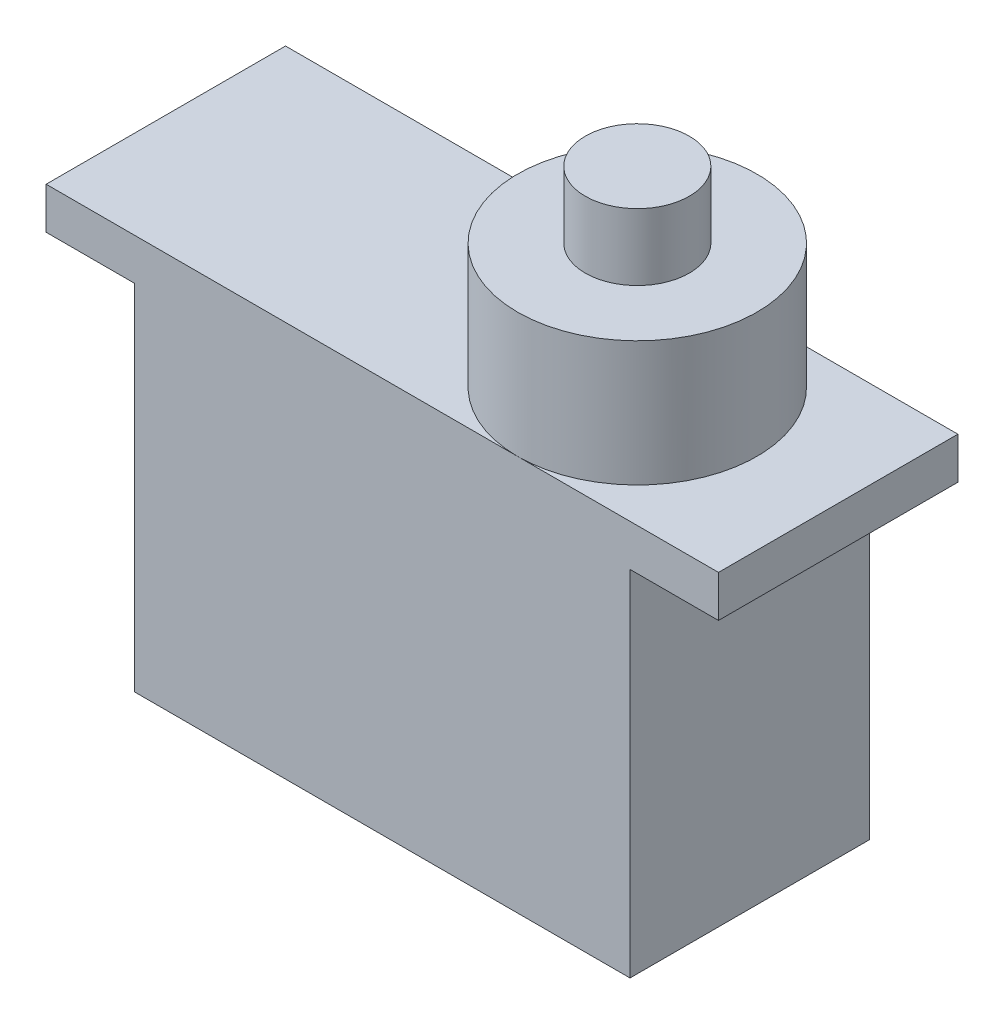
from build123d import *

# Parameters (mm, degrees)
SKETCH1_W           = 23.8
SKETCH1_H           = 11.5
BOSS_EXTRUDE1_DEPTH = 17
SKETCH2_W           = 32.3
SKETCH2_H           = 11.5
BOSS_EXTRUDE2_DEPTH = 2
SKETCH3_R           = 5.75
BOSS_EXTRUDE3_DEPTH = 6
SKETCH4_R           = 2.5
BOSS_EXTRUDE4_DEPTH = 3.2


with BuildPart() as part:
    # Sketch1 → Boss-Extrude1 (new body)
    with BuildSketch(Plane(origin=(0, 0, 0), x_dir=(1, 0, 0), z_dir=(0, 1, 0))):
        with Locations((11.9, 5.75)):
            Rectangle(SKETCH1_W, SKETCH1_H)
    extrude(amount=BOSS_EXTRUDE1_DEPTH)

    # Sketch2 → Boss-Extrude2 (add)
    with BuildSketch(Plane(origin=(0, 17, 0), x_dir=(1, 0, 0), z_dir=(0, 1, 0))):
        with Locations((11.9, 5.75)):
            Rectangle(SKETCH2_W, SKETCH2_H)
    extrude(amount=BOSS_EXTRUDE2_DEPTH)

    # Sketch3 → Boss-Extrude3 (add)
    with BuildSketch(Plane(origin=(0, 19, 0), x_dir=(1, 0, 0), z_dir=(0, 1, 0))):
        with Locations(Location((18.4, 5.75, 0), (0, 0, 270))):
            Circle(SKETCH3_R)
    extrude(amount=BOSS_EXTRUDE3_DEPTH)

    # Sketch4 → Boss-Extrude4 (add)
    with BuildSketch(Plane(origin=(0, 25, 0), x_dir=(1, 0, 0), z_dir=(0, 1, 0))):
        with Locations(Location((18.4, 5.75, 0), (0, 0, 270))):
            Circle(SKETCH4_R)
    extrude(amount=BOSS_EXTRUDE4_DEPTH)


solid = part.part
